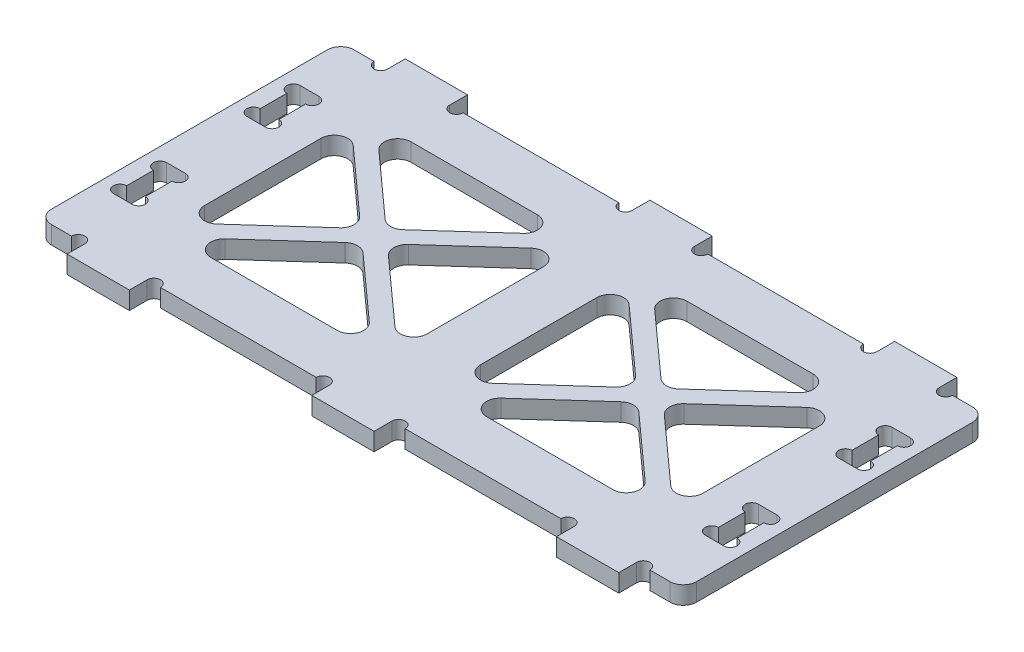
from build123d import *

# Parameters (mm, degrees)
SKETCH_1_W          = 14
SKETCH_1_H          = 4
SKETCH_1_W_2        = 145
SKETCH_1_H_2        = 68
EXTRUDE_1_DEPTH     = 4
SKETCH_2_R          = 1.5
CUT_EXTRUDE_1_DEPTH = 4
SKETCH_3_R          = 1.5
SKETCH_3_W          = 4.2
SKETCH_3_H          = 12
CUT_EXTRUDE_2_DEPTH = 10
CUT_EXTRUDE_3_DEPTH = 5
FILLET_1_R          = 3
FILLET_2_R          = 3


with BuildPart() as part:
    # 草图1 → 凸台-拉伸1 (new body)
    with BuildSketch(Plane(origin=(0, 0, 0), x_dir=(1, 0, 0), z_dir=(0, 1, 0))):
        with Locations((-55, -36)):
            Rectangle(SKETCH_1_W, SKETCH_1_H)
        Rectangle(SKETCH_1_W_2, SKETCH_1_H_2)
        with Locations((0, -36)):
            Rectangle(SKETCH_1_W, SKETCH_1_H)
        with Locations((55, -36)):
            Rectangle(SKETCH_1_W, SKETCH_1_H)
        with Locations((-55, 36)):
            Rectangle(SKETCH_1_W, SKETCH_1_H)
        with Locations((55, 36)):
            Rectangle(SKETCH_1_W, SKETCH_1_H)
        with Locations((0, 36)):
            Rectangle(SKETCH_1_W, SKETCH_1_H)
    extrude(amount=EXTRUDE_1_DEPTH)

    # 草图2 → 切除-拉伸1 (cut)
    with BuildSketch(Plane(origin=(0, 4, 0), x_dir=(1, 0, 0), z_dir=(0, 1, 0))):
        with Locations((-63.5, 34)):
            Circle(SKETCH_2_R)
        with Locations((-46.5, 34)):
            Circle(SKETCH_2_R)
        with Locations((-8.5, 34)):
            Circle(SKETCH_2_R)
        with Locations((-63.5, -34)):
            Circle(SKETCH_2_R)
        with Locations((-46.5, -34)):
            Circle(SKETCH_2_R)
        with Locations((-8.5, -34)):
            Circle(SKETCH_2_R)
        with Locations((8.5, 34)):
            Circle(SKETCH_2_R)
        with Locations((46.5, 34)):
            Circle(SKETCH_2_R)
        with Locations((46.5, -34)):
            Circle(SKETCH_2_R)
        with Locations((8.5, -34)):
            Circle(SKETCH_2_R)
        with Locations((63.5, -34)):
            Circle(SKETCH_2_R)
        with Locations((63.5, 34)):
            Circle(SKETCH_2_R)
    extrude(amount=-CUT_EXTRUDE_1_DEPTH, mode=Mode.SUBTRACT)

    # 草图3 → 切除-拉伸2 (cut)
    with BuildSketch(Plane(origin=(0, 4, 0), x_dir=(1, 0, 0), z_dir=(0, 1, 0))):
        with Locations((68.6, 10.5)):
            Circle(SKETCH_3_R)
        with Locations((68.6, 19.5)):
            Circle(SKETCH_3_R)
        with Locations((64.4, 19.5)):
            Circle(SKETCH_3_R)
        with Locations((64.4, 10.5)):
            Circle(SKETCH_3_R)
        with Locations((66.5, 15)):
            Rectangle(SKETCH_3_W, SKETCH_3_H)
        with BuildLine():
            ThreePointArc((65.9, 10.5), (65.460660172, 11.560660172), (64.4, 12))
            Line((64.4, 12), (64.4, 9))
            ThreePointArc((64.4, 9), (65.460660172, 9.439339828), (65.9, 10.5))
        make_face()
        with BuildLine():
            Line((64.4, 9), (64.4, 12))
            ThreePointArc((64.4, 12), (62.9, 10.5), (64.4, 9))
        make_face()
        with BuildLine():
            ThreePointArc((65.9, 19.5), (65.460660172, 20.560660172), (64.4, 21))
            Line((64.4, 21), (64.4, 18))
            ThreePointArc((64.4, 18), (65.460660172, 18.439339828), (65.9, 19.5))
        make_face()
        with BuildLine():
            Line((64.4, 18), (64.4, 21))
            ThreePointArc((64.4, 21), (62.9, 19.5), (64.4, 18))
        make_face()
        with BuildLine():
            ThreePointArc((70.1, 19.5), (69.660660172, 20.560660172), (68.6, 21))
            Line((68.6, 21), (68.6, 18))
            ThreePointArc((68.6, 18), (69.660660172, 18.439339828), (70.1, 19.5))
        make_face()
        with BuildLine():
            Line((68.6, 18), (68.6, 21))
            ThreePointArc((68.6, 21), (67.1, 19.5), (68.6, 18))
        make_face()
        with BuildLine():
            ThreePointArc((70.1, 10.5), (69.660660172, 11.560660172), (68.6, 12))
            Line((68.6, 12), (68.6, 9))
            ThreePointArc((68.6, 9), (69.660660172, 9.439339828), (70.1, 10.5))
        make_face()
        with BuildLine():
            Line((68.6, 9), (68.6, 12))
            ThreePointArc((68.6, 12), (67.1, 10.5), (68.6, 9))
        make_face()
        with BuildLine():
            ThreePointArc((64.4, -18), (62.9, -19.5), (64.4, -21))
            Line((64.4, -21), (64.4, -18))
        make_face()
        with BuildLine():
            Line((64.4, -18), (64.4, -21))
            ThreePointArc((64.4, -21), (65.460660172, -20.560660172), (65.9, -19.5))
            ThreePointArc((65.9, -19.5), (65.460660172, -18.439339828), (64.4, -18))
        make_face()
        with Locations((64.4, -19.5)):
            Circle(SKETCH_3_R)
        with Locations((68.6, -19.5)):
            Circle(SKETCH_3_R)
        with Locations((68.6, -10.5)):
            Circle(SKETCH_3_R)
        with Locations((64.4, -10.5)):
            Circle(SKETCH_3_R)
        with Locations((66.5, -15)):
            Rectangle(SKETCH_3_W, SKETCH_3_H)
        with BuildLine():
            ThreePointArc((68.6, -18), (67.1, -19.5), (68.6, -21))
            Line((68.6, -21), (68.6, -18))
        make_face()
        with BuildLine():
            Line((68.6, -18), (68.6, -21))
            ThreePointArc((68.6, -21), (69.660660172, -20.560660172), (70.1, -19.5))
            ThreePointArc((70.1, -19.5), (69.660660172, -18.439339828), (68.6, -18))
        make_face()
        with BuildLine():
            ThreePointArc((64.4, -9), (62.9, -10.5), (64.4, -12))
            Line((64.4, -12), (64.4, -9))
        make_face()
        with BuildLine():
            Line((64.4, -9), (64.4, -12))
            ThreePointArc((64.4, -12), (65.460660172, -11.560660172), (65.9, -10.5))
            ThreePointArc((65.9, -10.5), (65.460660172, -9.439339828), (64.4, -9))
        make_face()
        with BuildLine():
            ThreePointArc((68.6, -9), (67.1, -10.5), (68.6, -12))
            Line((68.6, -12), (68.6, -9))
        make_face()
        with BuildLine():
            Line((68.6, -9), (68.6, -12))
            ThreePointArc((68.6, -12), (69.660660172, -11.560660172), (70.1, -10.5))
            ThreePointArc((70.1, -10.5), (69.660660172, -9.439339828), (68.6, -9))
        make_face()
    cut_extrude_2 = extrude(amount=-CUT_EXTRUDE_2_DEPTH, mode=Mode.SUBTRACT)

    # 镜向1: 切除-拉伸2 across plane
    add(cut_extrude_2.mirror(Plane(origin=(0, 0, 0), x_dir=(0, 0, 1), z_dir=(1, 0, 0))), mode=Mode.SUBTRACT)

    # 草图4 → 切除-拉伸3 (cut)
    with BuildSketch(Plane(origin=(0, 4, 0), x_dir=(1, 0, 0), z_dir=(0, 1, 0))):
        Polygon((-33.989694233, 0), (-56, 19.809275191), (-56, -19.809275191), align=None)
        Polygon((-8.989694233, 22.5), (-53.010305767, 22.5), (-31, 2.690724809), align=None)
        Polygon((-6, 19.809275191), (-28.010305767, 0), (-6, -19.809275191), align=None)
        Polygon((-8.989694233, -22.5), (-31, -2.690724809), (-53.010305767, -22.5), align=None)
        Polygon((28.010305767, 0), (6, 19.809275191), (6, -19.809275191), align=None)
        Polygon((8.989694233, 22.5), (31, 2.690724809), (53.010305767, 22.5), align=None)
        Polygon((56, 19.809275191), (33.989694233, 0), (56, -19.809275191), align=None)
        Polygon((53.010305767, -22.5), (31, -2.690724809), (8.989694233, -22.5), align=None)
    extrude(amount=-CUT_EXTRUDE_3_DEPTH, mode=Mode.SUBTRACT)

    # 圆角1
    fillet_1_edges = [part.edges().sort_by_distance(p)[0] for p in [
        (6, 2, -19.809275191),
        (28.010305767, 2, 0),
        (6, 2, 19.809275191),
        (-31, 2, 2.690724809),
        (-8.989694233, 2, 22.5),
        (-53.010305767, 2, 22.5),
        (-8.989694233, 2, -22.5),
        (-31, 2, -2.690724809),
        (-53.010305767, 2, -22.5),
        (-6, 2, -19.809275191),
        (-6, 2, 19.809275191),
        (-28.010305767, 2, 0),
        (53.010305767, 2, 22.5),
        (8.989694233, 2, 22.5),
        (31, 2, 2.690724809),
        (53.010305767, 2, -22.5),
        (31, 2, -2.690724809),
        (8.989694233, 2, -22.5),
        (56, 2, -19.809275191),
        (56, 2, 19.809275191),
        (33.989694233, 2, 0),
        (-33.989694233, 2, 0),
        (-56, 2, 19.809275191),
        (-56, 2, -19.809275191),
    ]]
    fillet(fillet_1_edges, radius=FILLET_1_R)

    # 圆角2
    fillet_2_edges = [part.edges().sort_by_distance(p)[0] for p in [
        (-72.5, 2, 34),
        (-72.5, 2, -34),
        (72.5, 2, -34),
        (72.5, 2, 34),
    ]]
    fillet(fillet_2_edges, radius=FILLET_2_R)


solid = part.part
